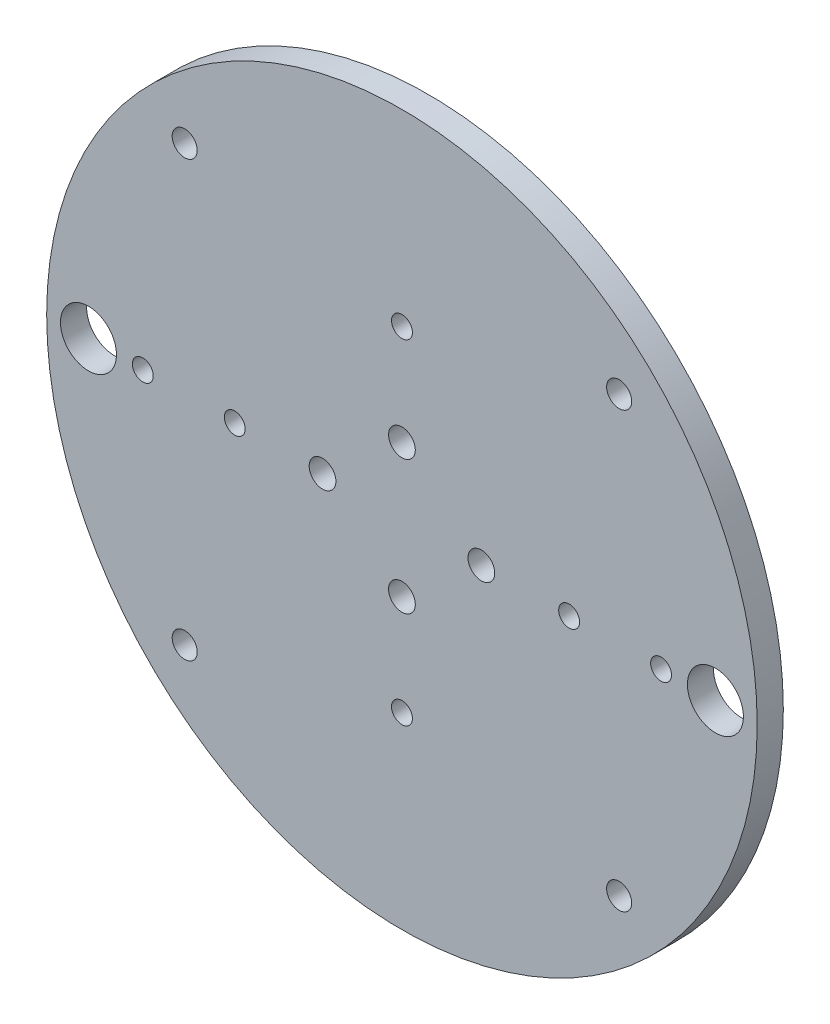
from build123d import *

# Parameters (mm, degrees)
SKETCH1_R           = 42.5
BOSS_EXTRUDE1_DEPTH = 3.125
SKETCH2_R           = 1.5
CUT_EXTRUDE1_DEPTH  = 61.185260862
SKETCH3_R           = 1.25
CUT_EXTRUDE2_DEPTH  = 61.185260862
SKETCH6_R           = 1.6
CUT_EXTRUDE3_DEPTH  = 61.185260862
SKETCH7_R           = 3.35
SKETCH7_R_2         = 1.25
CUT_EXTRUDE4_DEPTH  = 61.185260862


with BuildPart() as part:
    # Sketch1 → Boss-Extrude1 (new body)
    with BuildSketch(Plane.XY):
        Circle(SKETCH1_R)
    extrude(amount=BOSS_EXTRUDE1_DEPTH)

    # Sketch2 → Cut-Extrude1 (cut, through all)
    with BuildSketch(Plane(origin=(0, 0, 0), x_dir=(-1, 0, 0), z_dir=(0, 0, -1))):
        with Locations((25.986174209, -25.986174209)):
            Circle(SKETCH2_R)
        with Locations((-25.986174209, -25.986174209)):
            Circle(SKETCH2_R)
        with Locations((25.986174209, 25.986174209)):
            Circle(SKETCH2_R)
        with Locations((-25.986174209, 25.986174209)):
            Circle(SKETCH2_R)
    extrude(amount=-CUT_EXTRUDE1_DEPTH, mode=Mode.SUBTRACT)

    # Sketch3 → Cut-Extrude2 (cut, through all)
    with BuildSketch(Plane.XY.offset(3.125)):
        with Locations((0, 20)):
            Circle(SKETCH3_R)
        with Locations((20, 0)):
            Circle(SKETCH3_R)
        with Locations((0, -20)):
            Circle(SKETCH3_R)
        with Locations((-20, 0)):
            Circle(SKETCH3_R)
    extrude(amount=-CUT_EXTRUDE2_DEPTH, mode=Mode.SUBTRACT)

    # Sketch6 → Cut-Extrude3 (cut, through all)
    with BuildSketch(Plane.XY.offset(3.125)):
        with Locations((-9.5, 0)):
            Circle(SKETCH6_R)
        with Locations((0, 8)):
            Circle(SKETCH6_R)
        with Locations((9.5, 0)):
            Circle(SKETCH6_R)
        with Locations((0, -8)):
            Circle(SKETCH6_R)
    extrude(amount=-CUT_EXTRUDE3_DEPTH, mode=Mode.SUBTRACT)

    # Sketch7 → Cut-Extrude4 (cut, through all)
    with BuildSketch(Plane(origin=(0, 0, 0), x_dir=(-1, 0, 0), z_dir=(0, 0, -1))):
        with Locations((37.5, 0)):
            Circle(SKETCH7_R)
        with Locations((-37.5, 0)):
            Circle(SKETCH7_R)
        with Locations((-31, 0)):
            Circle(SKETCH7_R_2)
        with Locations((31, 0)):
            Circle(SKETCH7_R_2)
    extrude(amount=-CUT_EXTRUDE4_DEPTH, mode=Mode.SUBTRACT)


solid = part.part
